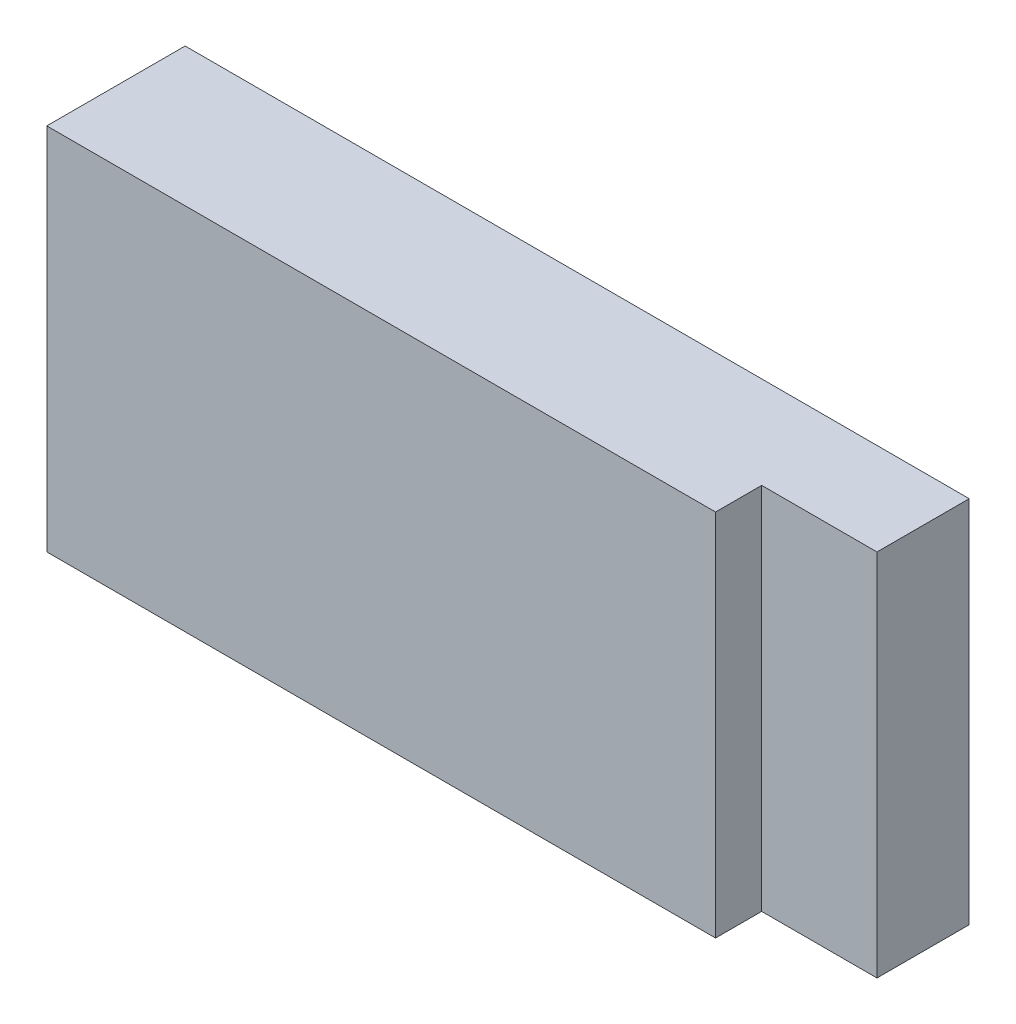
from build123d import *

# Parameters (mm, degrees)
SKETCH_1_W      = 34
SKETCH_1_H      = 16
EXTRUDE_1_DEPTH = 4
SKETCH_2_W      = 29
SKETCH_2_H      = 16
EXTRUDE_2_DEPTH = 2


with BuildPart() as part:
    # Эскиз1 → Бобышка-Вытянуть1 (new body)
    with BuildSketch(Plane.XY):
        with Locations((3.06360424, -0.61130742)):
            Rectangle(SKETCH_1_W, SKETCH_1_H)
    extrude(amount=EXTRUDE_1_DEPTH)

    # Эскиз2 → Бобышка-Вытянуть2 (add)
    with BuildSketch(Plane.XY.offset(4)):
        with Locations((0.56360424, -0.61130742)):
            Rectangle(SKETCH_2_W, SKETCH_2_H)
    extrude(amount=EXTRUDE_2_DEPTH)


solid = part.part
